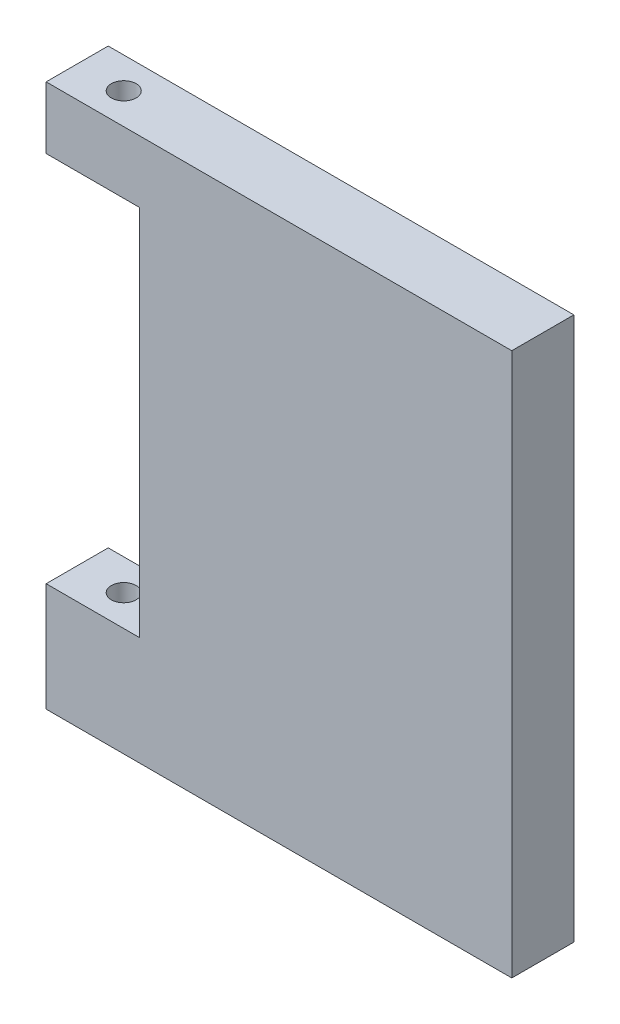
from build123d import *

# Parameters (mm, degrees)
EXTRUDE_1_DEPTH     = 40
SKETCH_2_R          = 8
CUT_EXTRUDE_1_DEPTH = 300
SKETCH_3_R          = 4
CUT_EXTRUDE_2_DEPTH = 50


with BuildPart() as part:
    # Эскиз1 → Бобышка-Вытянуть1 (new body)
    with BuildSketch(Plane.XY):
        Polygon((-300, 310), (-300, 350), (0, 350), (0, 0), (-300, 0), (-300, 70), (-240, 70), (-240, 310), align=None)
    extrude(amount=EXTRUDE_1_DEPTH)

    # Эскиз2 → Вырез-Вытянуть1 (cut)
    with BuildSketch(Plane(origin=(0, 350, 0), x_dir=(1, 0, 0), z_dir=(0, 1, 0))):
        with Locations(Location((-270, -20, 0), (0, 0, 180))):
            Circle(SKETCH_2_R)
    extrude(amount=-CUT_EXTRUDE_1_DEPTH, mode=Mode.SUBTRACT)

    # Эскиз3 → Вырез-Вытянуть2 (cut)
    with BuildSketch(Plane.XZ):
        with Locations(Location((-30, 20, 0), (0, 0, 270))):
            Circle(SKETCH_3_R)
        with Locations(Location((-120, 20, 0), (0, 0, 270))):
            Circle(SKETCH_3_R)
        with Locations(Location((-210, 20, 0), (0, 0, 270))):
            Circle(SKETCH_3_R)
    extrude(amount=-CUT_EXTRUDE_2_DEPTH, mode=Mode.SUBTRACT)


solid = part.part
